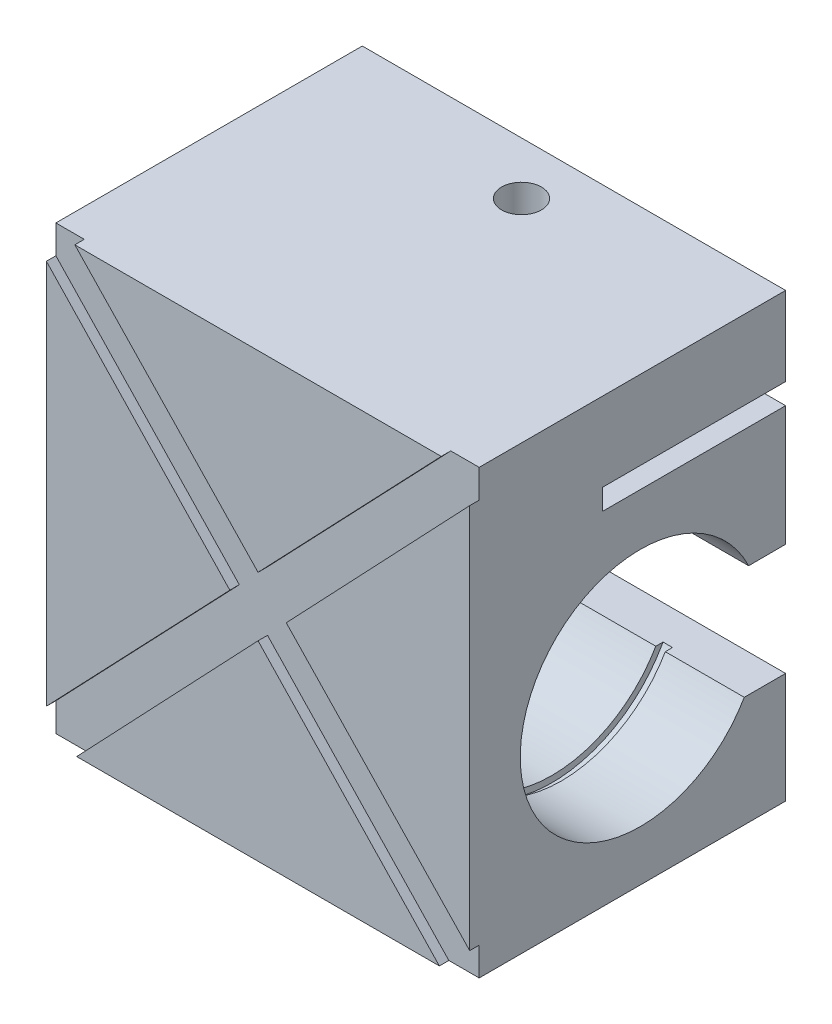
from build123d import *

# Parameters (mm, degrees)
SKETCH1_W           = 67
SKETCH1_H           = 70
BOSS_EXTRUDE1_DEPTH = 50
SKETCH5_R           = 3.15
CUT_EXTRUDE2_DEPTH  = 12.5
CUT_EXTRUDE3_DEPTH  = 1.5
SKETCH6_W           = 29
SKETCH6_H           = 3.3
CUT_EXTRUDE4_DEPTH  = 67
SKETCH7_R           = 20
CUT_EXTRUDE5_DEPTH  = 1.5
SKETCH8_R           = 20
CUT_EXTRUDE6_DEPTH  = 1.5


with BuildPart() as part:
    # Sketch1 → Boss-Extrude1 (new body)
    with BuildSketch(Plane.XY):
        Rectangle(SKETCH1_W, SKETCH1_H)
    extrude(amount=-BOSS_EXTRUDE1_DEPTH)

    # Sketch5 → Cut-Extrude2 (cut)
    with BuildSketch(Plane(origin=(0, 35, 0), x_dir=(1, 0, 0), z_dir=(0, 1, 0))):
        with Locations((0, 41.7)):
            Circle(SKETCH5_R)
    extrude(amount=-CUT_EXTRUDE2_DEPTH, mode=Mode.SUBTRACT)

    # Sketch1<4> → Cut-Extrude3 (cut)
    with BuildSketch(Plane.XY):
        Polygon((-4.46696193, -0.073376103), (-33.5, -30.5), (-33.5, -35), (-28.7, -35), (0, -4.77733119), (28.7, -35), (33.5, -35), (33.5, -30.5), (4.46696193, -0.073376103), (33.5, 30.5), (33.5, 35), (29, 35), (0, 4.608), (-29, 35), (-33.5, 35), (-33.5, 30.5), align=None)
    extrude(amount=-CUT_EXTRUDE3_DEPTH, mode=Mode.SUBTRACT)

    # Sketch6 → Cut-Extrude4 (cut)
    with BuildSketch(Plane(origin=(33.5, 0, 0), x_dir=(0, 0, -1), z_dir=(1, 0, 0))):
        with Locations((35.5, 20.85)):
            Rectangle(SKETCH6_W, SKETCH6_H)
        with BuildLine():
            Line((50, 0.2), (44.150602701, 0.176602411))
            ThreePointArc((44.150602701, 0.176602411), (8.01471599, -7.252342947), (43.454482672, -17.5))
            Line((43.454482672, -17.5), (50, -17.5))
            Line((50, -17.5), (50, 0.2))
        make_face()
    extrude(amount=-CUT_EXTRUDE4_DEPTH, mode=Mode.SUBTRACT)

    # Sketch7 → Cut-Extrude5 (cut)
    with BuildSketch(Plane(origin=(21, 0, 0), x_dir=(0, 0, -1), z_dir=(1, 0, 0))):
        with Locations((27, -8)):
            Circle(SKETCH7_R)
    extrude(amount=-CUT_EXTRUDE5_DEPTH, mode=Mode.SUBTRACT)

    # Sketch8 → Cut-Extrude6 (cut)
    with BuildSketch(Plane(origin=(-22.5, 0, 0), x_dir=(0, 0, -1), z_dir=(1, 0, 0))):
        with Locations((27, -8)):
            Circle(SKETCH8_R)
    extrude(amount=-CUT_EXTRUDE6_DEPTH, mode=Mode.SUBTRACT)


solid = part.part
